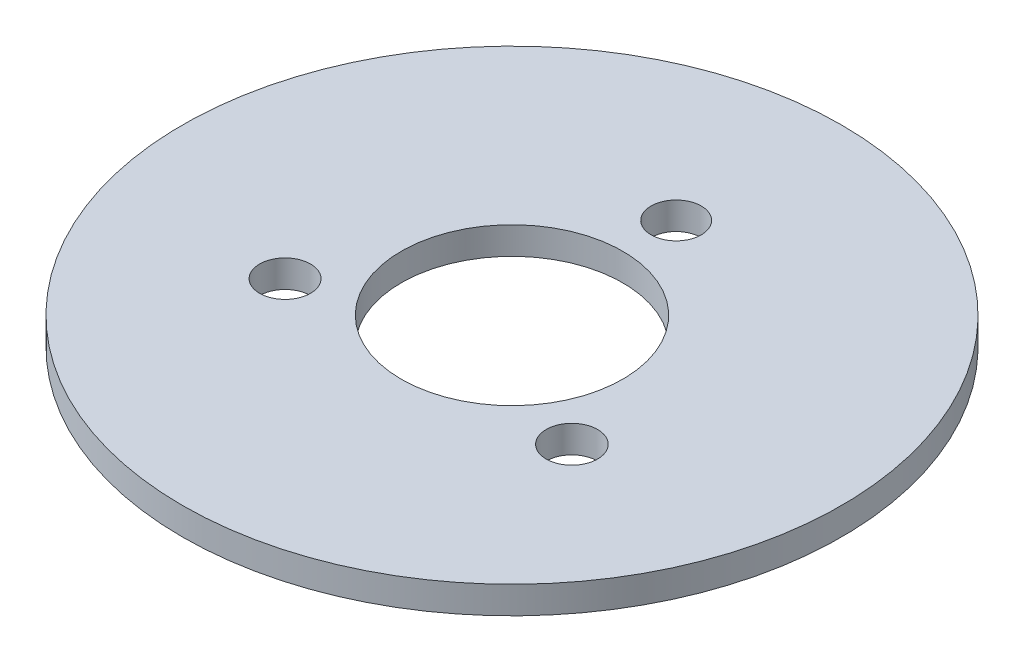
from build123d import *

# Parameters (mm, degrees)
SKETCH1_R           = 38.243875115
SKETCH1_R_2         = 12.860433797
SKETCH1_R_3         = 2.952880618
SKETCH1_R_4         = 2.979621757
SKETCH1_R_5         = 2.909102137
BOSS_EXTRUDE1_DEPTH = 3.175


with BuildPart() as part:
    # Sketch1 → Boss-Extrude1 (new body)
    with BuildSketch(Plane(origin=(0, 0, 0), x_dir=(1, 0, 0), z_dir=(0, 1, 0))):
        with Locations(Location((0, 0, 0), (0, 0, 270))):
            Circle(SKETCH1_R)
        with Locations(Location((0, 0, 0), (0, 0, 270))):
            Circle(SKETCH1_R_2, mode=Mode.SUBTRACT)
        with Locations(Location((-16.841170726, -9.494245367, 0), (0, 0, 270))):
            Circle(SKETCH1_R_3, mode=Mode.SUBTRACT)
        with Locations(Location((16.444515355, -9.494245367, 0), (0, 0, 270))):
            Circle(SKETCH1_R_4, mode=Mode.SUBTRACT)
        with Locations(Location((0, 19.05, 0), (0, 0, 270))):
            Circle(SKETCH1_R_5, mode=Mode.SUBTRACT)
    extrude(amount=BOSS_EXTRUDE1_DEPTH)


solid = part.part
